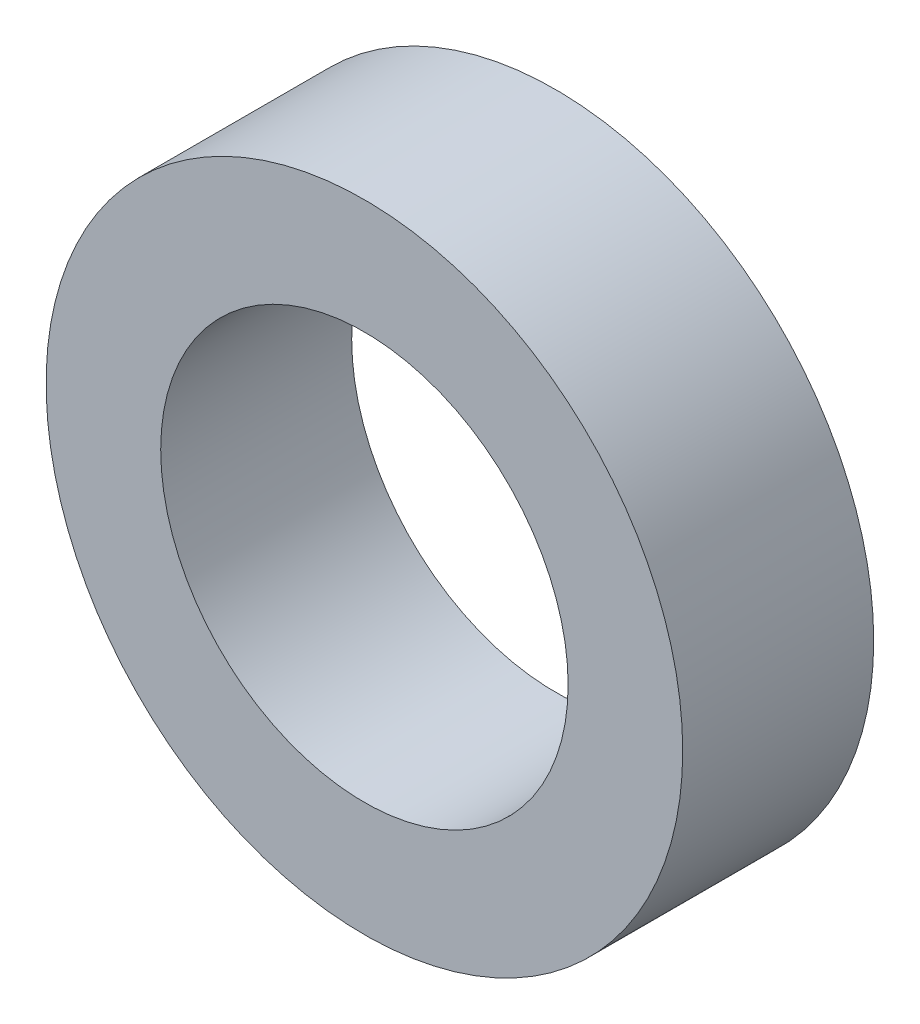
from build123d import *

# Parameters (mm, degrees)
EYELET_SPACER_OUTSIDE_SKETCH_R = 2.5
EYELET_SPACER_OUTSIDE_DEPTH    = 1.5
EYELET_SPACER_BORE_SKETCH_R    = 1.6
EYELET_SPACER_BORE_DEPTH       = 1.7


with BuildPart() as part:
    # Eyelet spacer outside sketch → Eyelet spacer outside (new body)
    with BuildSketch(Plane.XY.offset(11)):
        with Locations((35.708348754, -12)):
            Circle(EYELET_SPACER_OUTSIDE_SKETCH_R)
    extrude(amount=EYELET_SPACER_OUTSIDE_DEPTH)

    # Eyelet spacer bore sketch → Eyelet spacer bore (cut)
    with BuildSketch(Plane.XY.offset(10.9)):
        with Locations((35.708348754, -12)):
            Circle(EYELET_SPACER_BORE_SKETCH_R)
    extrude(amount=EYELET_SPACER_BORE_DEPTH, mode=Mode.SUBTRACT)


solid = part.part
